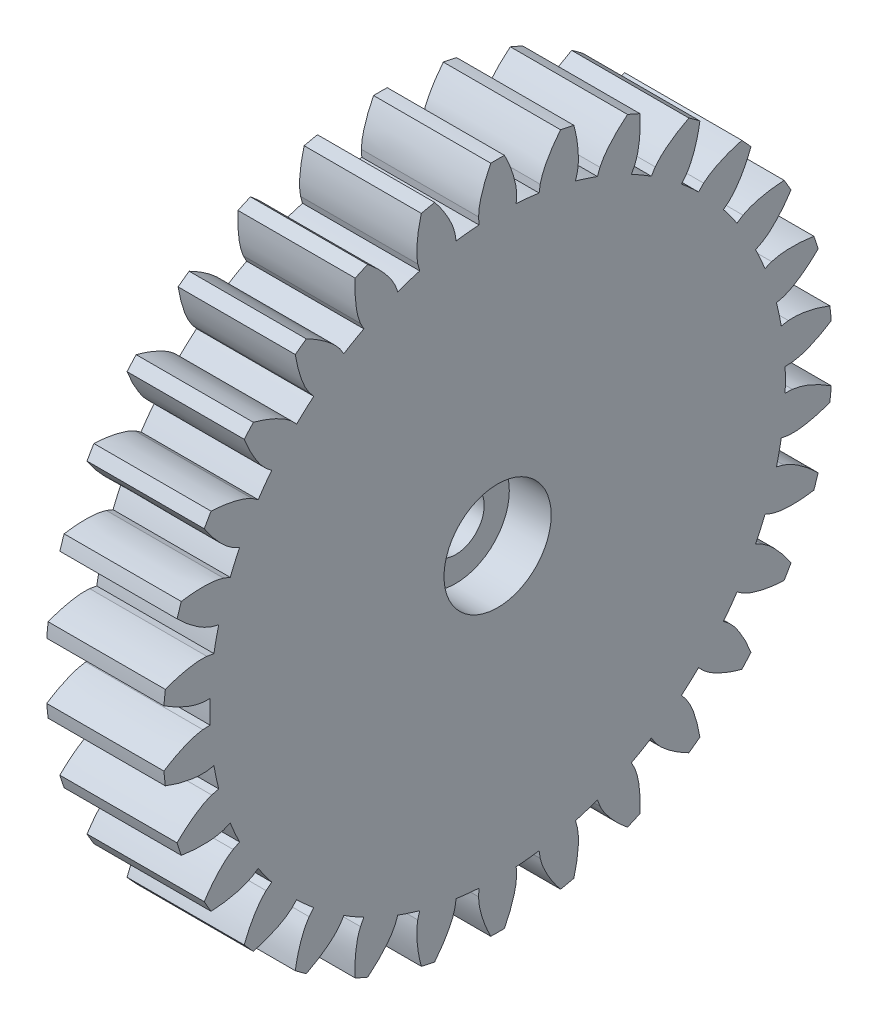
from build123d import *

# Parameters (mm, degrees)
PINION_START              = 21.05
PINION_30T_M1_25_DEPTH    = 7
TRIMMED_HORN_START        = 20.85
TRIMMED_HORN_POCKET_DEPTH = 2.5
M3_START                  = 20.85
SKETCH3_R                 = 1.7
M3_TO_SHAFT_DEPTH         = 7.4
HEAD_START                = 25.55
SKETCH4_R                 = 3.2
HEAD_COUNTERBORE_DEPTH    = 2.7


with BuildPart() as part:
    # Sketch1 → Pinion 30T m1.25 (new body)
    with BuildSketch(Plane(origin=(0, 0, 0), x_dir=(0, 0, -1), z_dir=(1, 0, 0)).offset(PINION_START)):
        with BuildLine():
            Line((21.658280741, 105.396257034), (21.232717923, 105.469008759))
            add(Edge.make_bspline(
                [(21.232717923, 105.469008759), (21.071946471, 105.475866412), (20.74593233, 105.489772437), (20.253508182, 105.422276796), (19.755885802, 105.31949669), (19.253713132, 105.177781813), (18.923440957, 105.056697693), (18.756288211, 104.995416288)],
                knots=[0, 0, 0, 0, 0.189677856, 0.384630872, 0.584678306, 0.789803179, 1, 1, 1, 1], degree=3))
            ThreePointArc((18.756288211, 104.995416288), (18.709562093, 104.590569265), (18.671094705, 104.184854215))
            add(Edge.make_bspline(
                [(18.671094705, 104.184854215), (18.821853641, 104.090158946), (19.119733773, 103.903053358), (19.581468585, 103.660027722), (20.046847537, 103.456032098), (20.514477903, 103.287630661), (20.836259078, 103.233450655), (20.994943074, 103.206732187)],
                knots=[0, 0, 0, 0, 0.210196821, 0.415321694, 0.615369128, 0.810322144, 1, 1, 1, 1], degree=3))
            Line((20.994943074, 103.206732187), (21.426332258, 103.189414628))
            ThreePointArc((21.426332258, 103.189414628), (21.4125, 102.5), (21.426332258, 101.810585372))
            Line((21.426332258, 101.810585372), (20.994943074, 101.793267813))
            add(Edge.make_bspline(
                [(20.994943074, 101.793267813), (20.836259078, 101.766549345), (20.514477903, 101.712369339), (20.046847537, 101.543967902), (19.581468585, 101.339972278), (19.119733773, 101.096946642), (18.821853641, 100.909841054), (18.671094705, 100.815145785)],
                knots=[0, 0, 0, 0, 0.189677856, 0.384630872, 0.584678306, 0.789803179, 1, 1, 1, 1], degree=3))
            ThreePointArc((18.671094705, 100.815145785), (18.709562093, 100.409430735), (18.756288211, 100.004583712))
            add(Edge.make_bspline(
                [(18.756288211, 100.004583712), (18.923440957, 99.943302307), (19.253713132, 99.822218187), (19.755885802, 99.68050331), (20.253508182, 99.577723204), (20.74593233, 99.510227563), (21.071946471, 99.524133588), (21.232717923, 99.530991241)],
                knots=[0, 0, 0, 0, 0.210196821, 0.415321694, 0.615369128, 0.810322144, 1, 1, 1, 1], degree=3))
            Line((21.232717923, 99.530991241), (21.658280741, 99.603742966))
            ThreePointArc((21.658280741, 99.603742966), (21.788088112, 98.926517814), (21.944955463, 98.255044438))
            Line((21.944955463, 98.255044438), (21.526593691, 98.148414454))
            add(Edge.make_bspline(
                [(21.526593691, 98.148414454), (21.376932403, 98.089287591), (21.073447575, 97.96938948), (20.651048682, 97.707442199), (20.238252452, 97.411146643), (19.837135524, 97.077431635), (19.584666227, 96.832481992), (19.456889989, 96.708511495)],
                knots=[0, 0, 0, 0, 0.189677856, 0.384630872, 0.584678306, 0.789803179, 1, 1, 1, 1], degree=3))
            ThreePointArc((19.456889989, 96.708511495), (19.578869674, 96.319660113), (19.708747144, 95.933374875))
            add(Edge.make_bspline(
                [(19.708747144, 95.933374875), (19.884988321, 95.908185625), (20.233218061, 95.85841493), (20.753881233, 95.824204432), (21.261998556, 95.827131829), (21.757695188, 95.863491867), (22.073693913, 95.944876163), (22.229526336, 95.985010224)],
                knots=[0, 0, 0, 0, 0.210196821, 0.415321694, 0.615369128, 0.810322144, 1, 1, 1, 1], degree=3))
            Line((22.229526336, 95.985010224), (22.630663652, 96.144651635))
            ThreePointArc((22.630663652, 96.144651635), (22.898437447, 95.509213947), (23.191484034, 94.885028431))
            Line((23.191484034, 94.885028431), (22.804434091, 94.693746265))
            add(Edge.make_bspline(
                [(22.804434091, 94.693746265), (22.670336427, 94.604795135), (22.39841169, 94.424419041), (22.039705129, 94.080374268), (21.697532796, 93.70472832), (21.374564487, 93.294908887), (21.178540145, 93.002820662), (21.079331039, 92.854993045)],
                knots=[0, 0, 0, 0, 0.189677856, 0.384630872, 0.584678306, 0.789803179, 1, 1, 1, 1], degree=3))
            ThreePointArc((21.079331039, 92.854993045), (21.279491924, 92.5), (21.486844477, 92.149159066))
            add(Edge.make_bspline(
                [(21.486844477, 92.149159066), (21.664471501, 92.161162863), (22.015439495, 92.184880811), (22.53183769, 92.259669855), (23.02824279, 92.368176813), (23.505547584, 92.506803422), (23.797720232, 92.652109105), (23.941803002, 92.723765523)],
                knots=[0, 0, 0, 0, 0.210196821, 0.415321694, 0.615369128, 0.810322144, 1, 1, 1, 1], degree=3))
            Line((23.941803002, 92.723765523), (24.30098319, 92.963319523))
            ThreePointArc((24.30098319, 92.963319523), (24.695020409, 92.397440976), (25.111438692, 91.847823223))
            Line((25.111438692, 91.847823223), (24.772616517, 91.580248823))
            add(Edge.make_bspline(
                [(24.772616517, 91.580248823), (24.659943189, 91.465361016), (24.431462958, 91.232390241), (24.152125926, 90.821284384), (23.895532065, 90.382705573), (23.664827639, 89.91469279), (23.533815455, 89.588231642), (23.467509397, 89.42300768)],
                knots=[0, 0, 0, 0, 0.189677856, 0.384630872, 0.584678306, 0.789803179, 1, 1, 1, 1], degree=3))
            ThreePointArc((23.467509397, 89.42300768), (23.73710349, 89.117387873), (24.012868824, 88.817324675))
            add(Edge.make_bspline(
                [(24.012868824, 88.817324675), (24.184118542, 88.865996895), (24.522485805, 88.962166898), (25.012049943, 89.142686844), (25.475047536, 89.352031088), (25.913099982, 89.58686562), (26.168677207, 89.789742134), (26.294713216, 89.88978918)],
                knots=[0, 0, 0, 0, 0.210196821, 0.415321694, 0.615369128, 0.810322144, 1, 1, 1, 1], degree=3))
            Line((26.294713216, 89.88978918), (26.596238377, 90.198786111))
            ThreePointArc((26.596238377, 90.198786111), (27.099317703, 89.727198312), (27.620908204, 89.276169255))
            Line((27.620908204, 89.276169255), (27.345121952, 88.943996906))
            add(Edge.make_bspline(
                [(27.345121952, 88.943996906), (27.258797325, 88.808193571), (27.083747283, 88.532810055), (26.895988149, 88.072610413), (26.736187141, 87.590266738), (26.60782949, 87.08451501), (26.547555326, 86.737948856), (26.517050208, 86.56254963)],
                knots=[0, 0, 0, 0, 0.189677856, 0.384630872, 0.584678306, 0.789803179, 1, 1, 1, 1], degree=3))
            ThreePointArc((26.517050208, 86.56254963), (26.844294954, 86.319660113), (27.1764208, 86.083488852))
            add(Edge.make_bspline(
                [(27.1764208, 86.083488852), (27.333808777, 86.166702286), (27.644787036, 86.331121253), (28.086120816, 86.609482513), (28.495475685, 86.910514696), (28.87513079, 87.231293754), (29.082942639, 87.482874423), (29.185423509, 87.60693956)],
                knots=[0, 0, 0, 0, 0.210196821, 0.415321694, 0.615369128, 0.810322144, 1, 1, 1, 1], degree=3))
            Line((29.185423509, 87.60693956), (29.416115547, 87.971874773))
            ThreePointArc((29.416115547, 87.971874773), (30.00625, 87.615188372), (30.61021671, 87.282460145))
            Line((30.61021671, 87.282460145), (30.409519565, 86.900207373))
            add(Edge.make_bspline(
                [(30.409519565, 86.900207373), (30.353316439, 86.749423768), (30.239347113, 86.443663092), (30.151371852, 85.954482598), (30.095347769, 85.449454791), (30.074946737, 84.928067896), (30.088044864, 84.57654334), (30.094673905, 84.398634637)],
                knots=[0, 0, 0, 0, 0.189677856, 0.384630872, 0.584678306, 0.789803179, 1, 1, 1, 1], degree=3))
            ThreePointArc((30.094673905, 84.398634637), (30.465267138, 84.229090847), (30.839238004, 84.067133342))
            add(Edge.make_bspline(
                [(30.839238004, 84.067133342), (30.975885631, 84.181251163), (31.245883642, 84.406733197), (31.619698661, 84.770770048), (31.957520033, 85.150333618), (32.262185047, 85.543037619), (32.413149147, 85.832327159), (32.487595971, 85.974988147)],
                knots=[0, 0, 0, 0, 0.210196821, 0.415321694, 0.615369128, 0.810322144, 1, 1, 1, 1], degree=3))
            Line((32.487595971, 85.974988147), (32.637372538, 86.379912221))
            ThreePointArc((32.637372538, 86.379912221), (33.288770409, 86.153716126), (33.948717086, 85.953830549))
            Line((33.948717086, 85.953830549), (33.831880475, 85.538203634))
            add(Edge.make_bspline(
                [(33.831880475, 85.538203634), (33.808255196, 85.379029725), (33.760347593, 85.056255099), (33.776001146, 84.559473287), (33.826202509, 84.053833487), (33.914649719, 83.539598534), (34.000547685, 83.198478887), (34.044021165, 83.025836171)],
                knots=[0, 0, 0, 0, 0.189677856, 0.384630872, 0.584678306, 0.789803179, 1, 1, 1, 1], degree=3))
            ThreePointArc((34.044021165, 83.025836171), (34.441766184, 82.937047985), (34.841237747, 82.856382555))
            add(Edge.make_bspline(
                [(34.841237747, 82.856382555), (34.951172866, 82.996417267), (35.168390423, 83.273107721), (35.458349169, 83.706910005), (35.70987263, 84.148416213), (35.92623223, 84.595882108), (36.013750724, 84.910237179), (36.056909819, 85.065259047)],
                knots=[0, 0, 0, 0, 0.210196821, 0.415321694, 0.615369128, 0.810322144, 1, 1, 1, 1], degree=3))
            Line((36.056909819, 85.065259047), (36.11922496, 85.492474858))
            ThreePointArc((36.11922496, 85.492474858), (36.803417038, 85.406654923), (37.490500845, 85.348347955))
            Line((37.490500845, 85.348347955), (37.462631088, 84.917511788))
            add(Edge.make_bspline(
                [(37.462631088, 84.917511788), (37.472616195, 84.75690424), (37.492864106, 84.431222463), (37.611462338, 83.948551081), (37.765695106, 83.464398175), (37.959124992, 82.979789698), (38.114068643, 82.663983525), (38.192486563, 82.504152111)],
                knots=[0, 0, 0, 0, 0.189677856, 0.384630872, 0.584678306, 0.789803179, 1, 1, 1, 1], degree=3))
            ThreePointArc((38.192486563, 82.504152111), (38.6, 82.5), (39.007513437, 82.504152111))
            add(Edge.make_bspline(
                [(39.007513437, 82.504152111), (39.085931357, 82.663983525), (39.240875008, 82.979789698), (39.434304894, 83.464398175), (39.588537662, 83.948551081), (39.707135894, 84.431222463), (39.727383805, 84.75690424), (39.737368912, 84.917511788)],
                knots=[0, 0, 0, 0, 0.210196821, 0.415321694, 0.615369128, 0.810322144, 1, 1, 1, 1], degree=3))
            Line((39.737368912, 84.917511788), (39.709499155, 85.348347955))
            ThreePointArc((39.709499155, 85.348347955), (40.396582962, 85.406654923), (41.08077504, 85.492474858))
            Line((41.08077504, 85.492474858), (41.143090181, 85.065259047))
            add(Edge.make_bspline(
                [(41.143090181, 85.065259047), (41.186249276, 84.910237179), (41.27376777, 84.595882108), (41.49012737, 84.148416213), (41.741650831, 83.706910005), (42.031609577, 83.273107721), (42.248827134, 82.996417267), (42.358762253, 82.856382555)],
                knots=[0, 0, 0, 0, 0.189677856, 0.384630872, 0.584678306, 0.789803179, 1, 1, 1, 1], degree=3))
            ThreePointArc((42.358762253, 82.856382555), (42.758233816, 82.937047985), (43.155978835, 83.025836171))
            add(Edge.make_bspline(
                [(43.155978835, 83.025836171), (43.199452315, 83.198478887), (43.285350281, 83.539598534), (43.373797491, 84.053833487), (43.423998854, 84.559473287), (43.439652407, 85.056255099), (43.391744804, 85.379029725), (43.368119525, 85.538203634)],
                knots=[0, 0, 0, 0, 0.210196821, 0.415321694, 0.615369128, 0.810322144, 1, 1, 1, 1], degree=3))
            Line((43.368119525, 85.538203634), (43.251282914, 85.953830549))
            ThreePointArc((43.251282914, 85.953830549), (43.911229591, 86.153716126), (44.562627462, 86.379912221))
            Line((44.562627462, 86.379912221), (44.712404029, 85.974988147))
            add(Edge.make_bspline(
                [(44.712404029, 85.974988147), (44.786850853, 85.832327159), (44.937814953, 85.543037619), (45.242479967, 85.150333618), (45.580301339, 84.770770048), (45.954116358, 84.406733197), (46.224114369, 84.181251163), (46.360761996, 84.067133342)],
                knots=[0, 0, 0, 0, 0.189677856, 0.384630872, 0.584678306, 0.789803179, 1, 1, 1, 1], degree=3))
            ThreePointArc((46.360761996, 84.067133342), (46.734732862, 84.229090847), (47.105326095, 84.398634637))
            add(Edge.make_bspline(
                [(47.105326095, 84.398634637), (47.111955136, 84.57654334), (47.125053263, 84.928067896), (47.104652231, 85.449454791), (47.048628148, 85.954482598), (46.960652887, 86.443663092), (46.846683561, 86.749423768), (46.790480435, 86.900207373)],
                knots=[0, 0, 0, 0, 0.210196821, 0.415321694, 0.615369128, 0.810322144, 1, 1, 1, 1], degree=3))
            Line((46.790480435, 86.900207373), (46.58978329, 87.282460145))
            ThreePointArc((46.58978329, 87.282460145), (47.19375, 87.615188372), (47.783884453, 87.971874773))
            Line((47.783884453, 87.971874773), (48.014576491, 87.60693956))
            add(Edge.make_bspline(
                [(48.014576491, 87.60693956), (48.117057361, 87.482874423), (48.32486921, 87.231293754), (48.704524315, 86.910514696), (49.113879184, 86.609482513), (49.555212964, 86.331121253), (49.866191223, 86.166702286), (50.0235792, 86.083488852)],
                knots=[0, 0, 0, 0, 0.189677856, 0.384630872, 0.584678306, 0.789803179, 1, 1, 1, 1], degree=3))
            ThreePointArc((50.0235792, 86.083488852), (50.355705046, 86.319660113), (50.682949792, 86.56254963))
            add(Edge.make_bspline(
                [(50.682949792, 86.56254963), (50.652444674, 86.737948856), (50.59217051, 87.08451501), (50.463812859, 87.590266738), (50.304011851, 88.072610413), (50.116252717, 88.532810055), (49.941202675, 88.808193571), (49.854878048, 88.943996906)],
                knots=[0, 0, 0, 0, 0.210196821, 0.415321694, 0.615369128, 0.810322144, 1, 1, 1, 1], degree=3))
            Line((49.854878048, 88.943996906), (49.579091796, 89.276169255))
            ThreePointArc((49.579091796, 89.276169255), (50.100682297, 89.727198312), (50.603761623, 90.198786111))
            Line((50.603761623, 90.198786111), (50.905286784, 89.88978918))
            add(Edge.make_bspline(
                [(50.905286784, 89.88978918), (51.031322793, 89.789742134), (51.286900018, 89.58686562), (51.724952464, 89.352031088), (52.187950057, 89.142686844), (52.677514195, 88.962166898), (53.015881458, 88.865996895), (53.187131176, 88.817324675)],
                knots=[0, 0, 0, 0, 0.189677856, 0.384630872, 0.584678306, 0.789803179, 1, 1, 1, 1], degree=3))
            ThreePointArc((53.187131176, 88.817324675), (53.46289651, 89.117387873), (53.732490603, 89.42300768))
            add(Edge.make_bspline(
                [(53.732490603, 89.42300768), (53.666184545, 89.588231642), (53.535172361, 89.91469279), (53.304467935, 90.382705573), (53.047874074, 90.821284384), (52.768537042, 91.232390241), (52.540056811, 91.465361016), (52.427383483, 91.580248823)],
                knots=[0, 0, 0, 0, 0.210196821, 0.415321694, 0.615369128, 0.810322144, 1, 1, 1, 1], degree=3))
            Line((52.427383483, 91.580248823), (52.088561308, 91.847823223))
            ThreePointArc((52.088561308, 91.847823223), (52.504979591, 92.397440976), (52.89901681, 92.963319523))
            Line((52.89901681, 92.963319523), (53.258196998, 92.723765523))
            add(Edge.make_bspline(
                [(53.258196998, 92.723765523), (53.402279768, 92.652109105), (53.694452416, 92.506803422), (54.17175721, 92.368176813), (54.66816231, 92.259669855), (55.184560505, 92.184880811), (55.535528499, 92.161162863), (55.713155523, 92.149159066)],
                knots=[0, 0, 0, 0, 0.189677856, 0.384630872, 0.584678306, 0.789803179, 1, 1, 1, 1], degree=3))
            ThreePointArc((55.713155523, 92.149159066), (55.920508076, 92.5), (56.120668961, 92.854993045))
            add(Edge.make_bspline(
                [(56.120668961, 92.854993045), (56.021459855, 93.002820662), (55.825435513, 93.294908887), (55.502467204, 93.70472832), (55.160294871, 94.080374268), (54.80158831, 94.424419041), (54.529663573, 94.604795135), (54.395565909, 94.693746265)],
                knots=[0, 0, 0, 0, 0.210196821, 0.415321694, 0.615369128, 0.810322144, 1, 1, 1, 1], degree=3))
            Line((54.395565909, 94.693746265), (54.008515966, 94.885028431))
            ThreePointArc((54.008515966, 94.885028431), (54.301562553, 95.509213947), (54.569336348, 96.144651635))
            Line((54.569336348, 96.144651635), (54.970473664, 95.985010224))
            add(Edge.make_bspline(
                [(54.970473664, 95.985010224), (55.126306087, 95.944876163), (55.442304812, 95.863491867), (55.938001444, 95.827131829), (56.446118767, 95.824204432), (56.966781939, 95.85841493), (57.315011679, 95.908185625), (57.491252856, 95.933374875)],
                knots=[0, 0, 0, 0, 0.189677856, 0.384630872, 0.584678306, 0.789803179, 1, 1, 1, 1], degree=3))
            ThreePointArc((57.491252856, 95.933374875), (57.621130326, 96.319660113), (57.743110011, 96.708511495))
            add(Edge.make_bspline(
                [(57.743110011, 96.708511495), (57.615333773, 96.832481992), (57.362864476, 97.077431635), (56.961747548, 97.411146643), (56.548951318, 97.707442199), (56.126552425, 97.96938948), (55.823067597, 98.089287591), (55.673406309, 98.148414454)],
                knots=[0, 0, 0, 0, 0.210196821, 0.415321694, 0.615369128, 0.810322144, 1, 1, 1, 1], degree=3))
            Line((55.673406309, 98.148414454), (55.255044537, 98.255044438))
            ThreePointArc((55.255044537, 98.255044438), (55.411911888, 98.926517814), (55.541719259, 99.603742966))
            Line((55.541719259, 99.603742966), (55.967282077, 99.530991241))
            add(Edge.make_bspline(
                [(55.967282077, 99.530991241), (56.128053529, 99.524133588), (56.45406767, 99.510227563), (56.946491818, 99.577723204), (57.444114198, 99.68050331), (57.946286868, 99.822218187), (58.276559043, 99.943302307), (58.443711789, 100.004583712)],
                knots=[0, 0, 0, 0, 0.189677856, 0.384630872, 0.584678306, 0.789803179, 1, 1, 1, 1], degree=3))
            ThreePointArc((58.443711789, 100.004583712), (58.490437907, 100.409430735), (58.528905295, 100.815145785))
            add(Edge.make_bspline(
                [(58.528905295, 100.815145785), (58.378146359, 100.909841054), (58.080266227, 101.096946642), (57.618531415, 101.339972278), (57.153152463, 101.543967902), (56.685522097, 101.712369339), (56.363740922, 101.766549345), (56.205056926, 101.793267813)],
                knots=[0, 0, 0, 0, 0.210196821, 0.415321694, 0.615369128, 0.810322144, 1, 1, 1, 1], degree=3))
            Line((56.205056926, 101.793267813), (55.773667742, 101.810585372))
            ThreePointArc((55.773667742, 101.810585372), (55.7875, 102.5), (55.773667742, 103.189414628))
            Line((55.773667742, 103.189414628), (56.205056926, 103.206732187))
            add(Edge.make_bspline(
                [(56.205056926, 103.206732187), (56.363740922, 103.233450655), (56.685522097, 103.287630661), (57.153152463, 103.456032098), (57.618531415, 103.660027722), (58.080266227, 103.903053358), (58.378146359, 104.090158946), (58.528905295, 104.184854215)],
                knots=[0, 0, 0, 0, 0.189677856, 0.384630872, 0.584678306, 0.789803179, 1, 1, 1, 1], degree=3))
            ThreePointArc((58.528905295, 104.184854215), (58.490437907, 104.590569265), (58.443711789, 104.995416288))
            add(Edge.make_bspline(
                [(58.443711789, 104.995416288), (58.276559043, 105.056697693), (57.946286868, 105.177781813), (57.444114198, 105.31949669), (56.946491818, 105.422276796), (56.45406767, 105.489772437), (56.128053529, 105.475866412), (55.967282077, 105.469008759)],
                knots=[0, 0, 0, 0, 0.210196821, 0.415321694, 0.615369128, 0.810322144, 1, 1, 1, 1], degree=3))
            Line((55.967282077, 105.469008759), (55.541719259, 105.396257034))
            ThreePointArc((55.541719259, 105.396257034), (55.411911888, 106.073482186), (55.255044537, 106.744955562))
            Line((55.255044537, 106.744955562), (55.673406309, 106.851585546))
            add(Edge.make_bspline(
                [(55.673406309, 106.851585546), (55.823067597, 106.910712409), (56.126552425, 107.03061052), (56.548951318, 107.292557801), (56.961747548, 107.588853357), (57.362864476, 107.922568365), (57.615333773, 108.167518008), (57.743110011, 108.291488505)],
                knots=[0, 0, 0, 0, 0.189677856, 0.384630872, 0.584678306, 0.789803179, 1, 1, 1, 1], degree=3))
            ThreePointArc((57.743110011, 108.291488505), (57.621130326, 108.680339887), (57.491252856, 109.066625125))
            add(Edge.make_bspline(
                [(57.491252856, 109.066625125), (57.315011679, 109.091814375), (56.966781939, 109.14158507), (56.446118767, 109.175795568), (55.938001444, 109.172868171), (55.442304812, 109.136508133), (55.126306087, 109.055123837), (54.970473664, 109.014989776)],
                knots=[0, 0, 0, 0, 0.210196821, 0.415321694, 0.615369128, 0.810322144, 1, 1, 1, 1], degree=3))
            Line((54.970473664, 109.014989776), (54.569336348, 108.855348365))
            ThreePointArc((54.569336348, 108.855348365), (54.301562553, 109.490786053), (54.008515966, 110.114971569))
            Line((54.008515966, 110.114971569), (54.395565909, 110.306253735))
            add(Edge.make_bspline(
                [(54.395565909, 110.306253735), (54.529663573, 110.395204865), (54.80158831, 110.575580959), (55.160294871, 110.919625732), (55.502467204, 111.29527168), (55.825435513, 111.705091113), (56.021459855, 111.997179338), (56.120668961, 112.145006955)],
                knots=[0, 0, 0, 0, 0.189677856, 0.384630872, 0.584678306, 0.789803179, 1, 1, 1, 1], degree=3))
            ThreePointArc((56.120668961, 112.145006955), (55.920508076, 112.5), (55.713155523, 112.850840934))
            add(Edge.make_bspline(
                [(55.713155523, 112.850840934), (55.535528499, 112.838837137), (55.184560505, 112.815119189), (54.66816231, 112.740330145), (54.17175721, 112.631823187), (53.694452416, 112.493196578), (53.402279768, 112.347890895), (53.258196998, 112.276234477)],
                knots=[0, 0, 0, 0, 0.210196821, 0.415321694, 0.615369128, 0.810322144, 1, 1, 1, 1], degree=3))
            Line((53.258196998, 112.276234477), (52.89901681, 112.036680477))
            ThreePointArc((52.89901681, 112.036680477), (52.504979591, 112.602559024), (52.088561308, 113.152176777))
            Line((52.088561308, 113.152176777), (52.427383483, 113.419751177))
            add(Edge.make_bspline(
                [(52.427383483, 113.419751177), (52.540056811, 113.534638984), (52.768537042, 113.767609759), (53.047874074, 114.178715616), (53.304467935, 114.617294427), (53.535172361, 115.08530721), (53.666184545, 115.411768358), (53.732490603, 115.57699232)],
                knots=[0, 0, 0, 0, 0.189677856, 0.384630872, 0.584678306, 0.789803179, 1, 1, 1, 1], degree=3))
            ThreePointArc((53.732490603, 115.57699232), (53.46289651, 115.882612127), (53.187131176, 116.182675325))
            add(Edge.make_bspline(
                [(53.187131176, 116.182675325), (53.015881458, 116.134003105), (52.677514195, 116.037833102), (52.187950057, 115.857313156), (51.724952464, 115.647968912), (51.286900018, 115.41313438), (51.031322793, 115.210257866), (50.905286784, 115.11021082)],
                knots=[0, 0, 0, 0, 0.210196821, 0.415321694, 0.615369128, 0.810322144, 1, 1, 1, 1], degree=3))
            Line((50.905286784, 115.11021082), (50.603761623, 114.801213889))
            ThreePointArc((50.603761623, 114.801213889), (50.100682297, 115.272801688), (49.579091796, 115.723830745))
            Line((49.579091796, 115.723830745), (49.854878048, 116.056003094))
            add(Edge.make_bspline(
                [(49.854878048, 116.056003094), (49.941202675, 116.191806429), (50.116252717, 116.467189945), (50.304011851, 116.927389587), (50.463812859, 117.409733262), (50.59217051, 117.91548499), (50.652444674, 118.262051144), (50.682949792, 118.43745037)],
                knots=[0, 0, 0, 0, 0.189677856, 0.384630872, 0.584678306, 0.789803179, 1, 1, 1, 1], degree=3))
            ThreePointArc((50.682949792, 118.43745037), (50.355705046, 118.680339887), (50.0235792, 118.916511148))
            add(Edge.make_bspline(
                [(50.0235792, 118.916511148), (49.866191223, 118.833297714), (49.555212964, 118.668878747), (49.113879184, 118.390517487), (48.704524315, 118.089485304), (48.32486921, 117.768706246), (48.117057361, 117.517125577), (48.014576491, 117.39306044)],
                knots=[0, 0, 0, 0, 0.210196821, 0.415321694, 0.615369128, 0.810322144, 1, 1, 1, 1], degree=3))
            Line((48.014576491, 117.39306044), (47.783884453, 117.028125227))
            ThreePointArc((47.783884453, 117.028125227), (47.19375, 117.384811628), (46.58978329, 117.717539855))
            Line((46.58978329, 117.717539855), (46.790480435, 118.099792627))
            add(Edge.make_bspline(
                [(46.790480435, 118.099792627), (46.846683561, 118.250576232), (46.960652887, 118.556336908), (47.048628148, 119.045517402), (47.104652231, 119.550545209), (47.125053263, 120.071932104), (47.111955136, 120.42345666), (47.105326095, 120.601365363)],
                knots=[0, 0, 0, 0, 0.189677856, 0.384630872, 0.584678306, 0.789803179, 1, 1, 1, 1], degree=3))
            ThreePointArc((47.105326095, 120.601365363), (46.734732862, 120.770909153), (46.360761996, 120.932866658))
            add(Edge.make_bspline(
                [(46.360761996, 120.932866658), (46.224114369, 120.818748837), (45.954116358, 120.593266803), (45.580301339, 120.229229952), (45.242479967, 119.849666382), (44.937814953, 119.456962381), (44.786850853, 119.167672841), (44.712404029, 119.025011853)],
                knots=[0, 0, 0, 0, 0.210196821, 0.415321694, 0.615369128, 0.810322144, 1, 1, 1, 1], degree=3))
            Line((44.712404029, 119.025011853), (44.562627462, 118.620087779))
            ThreePointArc((44.562627462, 118.620087779), (43.911229591, 118.846283874), (43.251282914, 119.046169451))
            Line((43.251282914, 119.046169451), (43.368119525, 119.461796366))
            add(Edge.make_bspline(
                [(43.368119525, 119.461796366), (43.391744804, 119.620970275), (43.439652407, 119.943744901), (43.423998854, 120.440526713), (43.373797491, 120.946166513), (43.285350281, 121.460401466), (43.199452315, 121.801521113), (43.155978835, 121.974163829)],
                knots=[0, 0, 0, 0, 0.189677856, 0.384630872, 0.584678306, 0.789803179, 1, 1, 1, 1], degree=3))
            ThreePointArc((43.155978835, 121.974163829), (42.758233816, 122.062952015), (42.358762253, 122.143617445))
            add(Edge.make_bspline(
                [(42.358762253, 122.143617445), (42.248827134, 122.003582733), (42.031609577, 121.726892279), (41.741650831, 121.293089995), (41.49012737, 120.851583787), (41.27376777, 120.404117892), (41.186249276, 120.089762821), (41.143090181, 119.934740953)],
                knots=[0, 0, 0, 0, 0.210196821, 0.415321694, 0.615369128, 0.810322144, 1, 1, 1, 1], degree=3))
            Line((41.143090181, 119.934740953), (41.08077504, 119.507525142))
            ThreePointArc((41.08077504, 119.507525142), (40.396582962, 119.593345077), (39.709499155, 119.651652045))
            Line((39.709499155, 119.651652045), (39.737368912, 120.082488212))
            add(Edge.make_bspline(
                [(39.737368912, 120.082488212), (39.727383805, 120.24309576), (39.707135894, 120.568777537), (39.588537662, 121.051448919), (39.434304894, 121.535601825), (39.240875008, 122.020210302), (39.085931357, 122.336016475), (39.007513437, 122.495847889)],
                knots=[0, 0, 0, 0, 0.189677856, 0.384630872, 0.584678306, 0.789803179, 1, 1, 1, 1], degree=3))
            ThreePointArc((39.007513437, 122.495847889), (38.6, 122.5), (38.192486563, 122.495847889))
            add(Edge.make_bspline(
                [(38.192486563, 122.495847889), (38.114068643, 122.336016475), (37.959124992, 122.020210302), (37.765695106, 121.535601825), (37.611462338, 121.051448919), (37.492864106, 120.568777537), (37.472616195, 120.24309576), (37.462631088, 120.082488212)],
                knots=[0, 0, 0, 0, 0.210196821, 0.415321694, 0.615369128, 0.810322144, 1, 1, 1, 1], degree=3))
            Line((37.462631088, 120.082488212), (37.490500845, 119.651652045))
            ThreePointArc((37.490500845, 119.651652045), (36.803417038, 119.593345077), (36.11922496, 119.507525142))
            Line((36.11922496, 119.507525142), (36.056909819, 119.934740953))
            add(Edge.make_bspline(
                [(36.056909819, 119.934740953), (36.013750724, 120.089762821), (35.92623223, 120.404117892), (35.70987263, 120.851583787), (35.458349169, 121.293089995), (35.168390423, 121.726892279), (34.951172866, 122.003582733), (34.841237747, 122.143617445)],
                knots=[0, 0, 0, 0, 0.189677856, 0.384630872, 0.584678306, 0.789803179, 1, 1, 1, 1], degree=3))
            ThreePointArc((34.841237747, 122.143617445), (34.441766184, 122.062952015), (34.044021165, 121.974163829))
            add(Edge.make_bspline(
                [(34.044021165, 121.974163829), (34.000547685, 121.801521113), (33.914649719, 121.460401466), (33.826202509, 120.946166513), (33.776001146, 120.440526713), (33.760347593, 119.943744901), (33.808255196, 119.620970275), (33.831880475, 119.461796366)],
                knots=[0, 0, 0, 0, 0.210196821, 0.415321694, 0.615369128, 0.810322144, 1, 1, 1, 1], degree=3))
            Line((33.831880475, 119.461796366), (33.948717086, 119.046169451))
            ThreePointArc((33.948717086, 119.046169451), (33.288770409, 118.846283874), (32.637372538, 118.620087779))
            Line((32.637372538, 118.620087779), (32.487595971, 119.025011853))
            add(Edge.make_bspline(
                [(32.487595971, 119.025011853), (32.413149147, 119.167672841), (32.262185047, 119.456962381), (31.957520033, 119.849666382), (31.619698661, 120.229229952), (31.245883642, 120.593266803), (30.975885631, 120.818748837), (30.839238004, 120.932866658)],
                knots=[0, 0, 0, 0, 0.189677856, 0.384630872, 0.584678306, 0.789803179, 1, 1, 1, 1], degree=3))
            ThreePointArc((30.839238004, 120.932866658), (30.465267138, 120.770909153), (30.094673905, 120.601365363))
            add(Edge.make_bspline(
                [(30.094673905, 120.601365363), (30.088044864, 120.42345666), (30.074946737, 120.071932104), (30.095347769, 119.550545209), (30.151371852, 119.045517402), (30.239347113, 118.556336908), (30.353316439, 118.250576232), (30.409519565, 118.099792627)],
                knots=[0, 0, 0, 0, 0.210196821, 0.415321694, 0.615369128, 0.810322144, 1, 1, 1, 1], degree=3))
            Line((30.409519565, 118.099792627), (30.61021671, 117.717539855))
            ThreePointArc((30.61021671, 117.717539855), (30.00625, 117.384811628), (29.416115547, 117.028125227))
            Line((29.416115547, 117.028125227), (29.185423509, 117.39306044))
            add(Edge.make_bspline(
                [(29.185423509, 117.39306044), (29.082942639, 117.517125577), (28.87513079, 117.768706246), (28.495475685, 118.089485304), (28.086120816, 118.390517487), (27.644787036, 118.668878747), (27.333808777, 118.833297714), (27.1764208, 118.916511148)],
                knots=[0, 0, 0, 0, 0.189677856, 0.384630872, 0.584678306, 0.789803179, 1, 1, 1, 1], degree=3))
            ThreePointArc((27.1764208, 118.916511148), (26.844294954, 118.680339887), (26.517050208, 118.43745037))
            add(Edge.make_bspline(
                [(26.517050208, 118.43745037), (26.547555326, 118.262051144), (26.60782949, 117.91548499), (26.736187141, 117.409733262), (26.895988149, 116.927389587), (27.083747283, 116.467189945), (27.258797325, 116.191806429), (27.345121952, 116.056003094)],
                knots=[0, 0, 0, 0, 0.210196821, 0.415321694, 0.615369128, 0.810322144, 1, 1, 1, 1], degree=3))
            Line((27.345121952, 116.056003094), (27.620908204, 115.723830745))
            ThreePointArc((27.620908204, 115.723830745), (27.099317703, 115.272801688), (26.596238377, 114.801213889))
            Line((26.596238377, 114.801213889), (26.294713216, 115.11021082))
            add(Edge.make_bspline(
                [(26.294713216, 115.11021082), (26.168677207, 115.210257866), (25.913099982, 115.41313438), (25.475047536, 115.647968912), (25.012049943, 115.857313156), (24.522485805, 116.037833102), (24.184118542, 116.134003105), (24.012868824, 116.182675325)],
                knots=[0, 0, 0, 0, 0.189677856, 0.384630872, 0.584678306, 0.789803179, 1, 1, 1, 1], degree=3))
            ThreePointArc((24.012868824, 116.182675325), (23.73710349, 115.882612127), (23.467509397, 115.57699232))
            add(Edge.make_bspline(
                [(23.467509397, 115.57699232), (23.533815455, 115.411768358), (23.664827639, 115.08530721), (23.895532065, 114.617294427), (24.152125926, 114.178715616), (24.431462958, 113.767609759), (24.659943189, 113.534638984), (24.772616517, 113.419751177)],
                knots=[0, 0, 0, 0, 0.210196821, 0.415321694, 0.615369128, 0.810322144, 1, 1, 1, 1], degree=3))
            Line((24.772616517, 113.419751177), (25.111438692, 113.152176777))
            ThreePointArc((25.111438692, 113.152176777), (24.695020409, 112.602559024), (24.30098319, 112.036680477))
            Line((24.30098319, 112.036680477), (23.941803002, 112.276234477))
            add(Edge.make_bspline(
                [(23.941803002, 112.276234477), (23.797720232, 112.347890895), (23.505547584, 112.493196578), (23.02824279, 112.631823187), (22.53183769, 112.740330145), (22.015439495, 112.815119189), (21.664471501, 112.838837137), (21.486844477, 112.850840934)],
                knots=[0, 0, 0, 0, 0.189677856, 0.384630872, 0.584678306, 0.789803179, 1, 1, 1, 1], degree=3))
            ThreePointArc((21.486844477, 112.850840934), (21.279491924, 112.5), (21.079331039, 112.145006955))
            add(Edge.make_bspline(
                [(21.079331039, 112.145006955), (21.178540145, 111.997179338), (21.374564487, 111.705091113), (21.697532796, 111.29527168), (22.039705129, 110.919625732), (22.39841169, 110.575580959), (22.670336427, 110.395204865), (22.804434091, 110.306253735)],
                knots=[0, 0, 0, 0, 0.210196821, 0.415321694, 0.615369128, 0.810322144, 1, 1, 1, 1], degree=3))
            Line((22.804434091, 110.306253735), (23.191484034, 110.114971569))
            ThreePointArc((23.191484034, 110.114971569), (22.898437447, 109.490786053), (22.630663652, 108.855348365))
            Line((22.630663652, 108.855348365), (22.229526336, 109.014989776))
            add(Edge.make_bspline(
                [(22.229526336, 109.014989776), (22.073693913, 109.055123837), (21.757695188, 109.136508133), (21.261998556, 109.172868171), (20.753881233, 109.175795568), (20.233218061, 109.14158507), (19.884988321, 109.091814375), (19.708747144, 109.066625125)],
                knots=[0, 0, 0, 0, 0.189677856, 0.384630872, 0.584678306, 0.789803179, 1, 1, 1, 1], degree=3))
            ThreePointArc((19.708747144, 109.066625125), (19.578869674, 108.680339887), (19.456889989, 108.291488505))
            add(Edge.make_bspline(
                [(19.456889989, 108.291488505), (19.584666227, 108.167518008), (19.837135524, 107.922568365), (20.238252452, 107.588853357), (20.651048682, 107.292557801), (21.073447575, 107.03061052), (21.376932403, 106.910712409), (21.526593691, 106.851585546)],
                knots=[0, 0, 0, 0, 0.210196821, 0.415321694, 0.615369128, 0.810322144, 1, 1, 1, 1], degree=3))
            Line((21.526593691, 106.851585546), (21.944955463, 106.744955562))
            ThreePointArc((21.944955463, 106.744955562), (21.788088112, 106.073482186), (21.658280741, 105.396257034))
        make_face()
    extrude(amount=PINION_30T_M1_25_DEPTH)

    # Sketch2 → Trimmed-horn pocket (cut)
    with BuildSketch(Plane(origin=(0, 0, 0), x_dir=(0, 0, -1), z_dir=(1, 0, 0)).offset(TRIMMED_HORN_START)):
        with BuildLine():
            Line((34.2, 91.4), (34.2, 113.6))
            ThreePointArc((34.2, 113.6), (38.6, 118), (43, 113.6))
            Line((43, 113.6), (43, 91.4))
            ThreePointArc((43, 91.4), (38.6, 87), (34.2, 91.4))
        make_face()
    extrude(amount=TRIMMED_HORN_POCKET_DEPTH, mode=Mode.SUBTRACT)

    # Sketch3 → M3 to shaft (cut)
    with BuildSketch(Plane(origin=(0, 0, 0), x_dir=(0, 0, -1), z_dir=(1, 0, 0)).offset(M3_START)):
        with Locations(Location((38.6, 102.5, 0), (0, 0, 180))):
            Circle(SKETCH3_R)
    extrude(amount=M3_TO_SHAFT_DEPTH, mode=Mode.SUBTRACT)

    # Sketch4 → Head counterbore (cut)
    with BuildSketch(Plane(origin=(0, 0, 0), x_dir=(0, 0, -1), z_dir=(1, 0, 0)).offset(HEAD_START)):
        with Locations((38.6, 102.5)):
            Circle(SKETCH4_R)
    extrude(amount=HEAD_COUNTERBORE_DEPTH, mode=Mode.SUBTRACT)


solid = part.part
